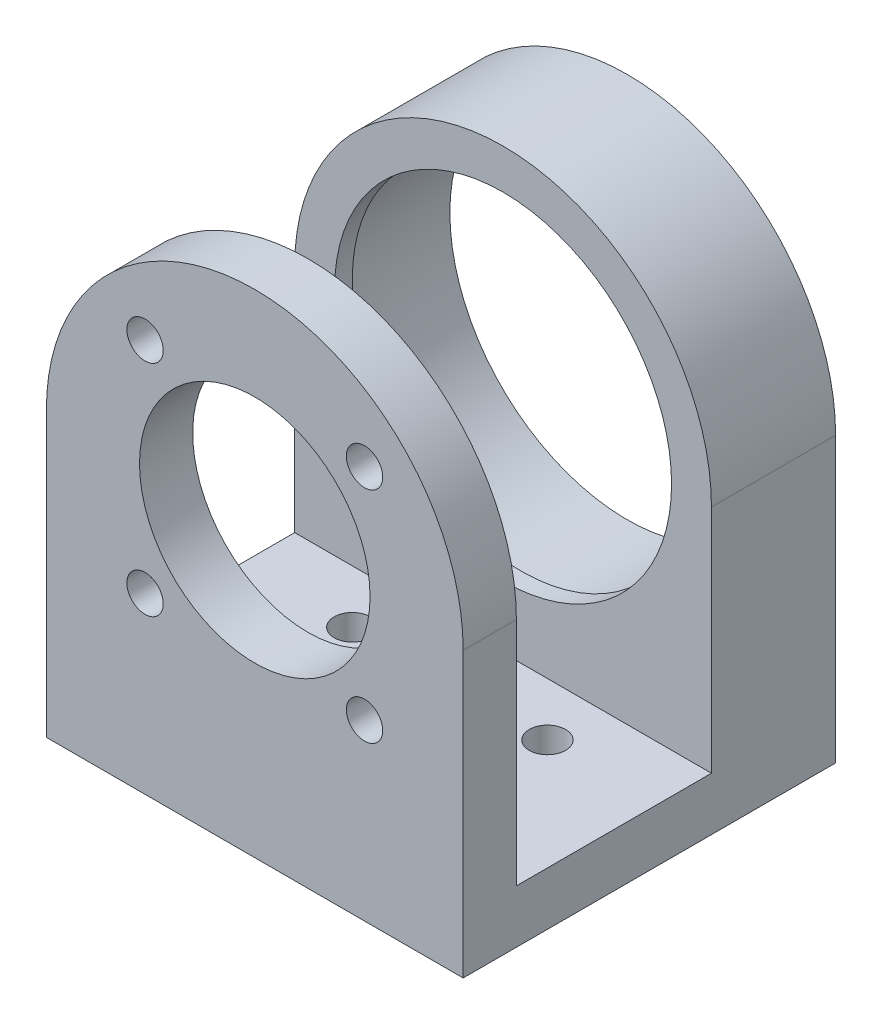
from build123d import *

# Parameters (mm, degrees)
EXTRUDE_1_DEPTH        = 36
SKETCH_3_R             = 13
CUT_EXTRUDE_1_DEPTH    = 20
HOLE_WIZARD_M4_1_D     = 4.1
HOLE_WIZARD_M4_1_DEPTH = 20
HOLE_WIZARD_M4_1_TIP   = 1.231764269
SKETCH_17_W            = 22
SKETCH_17_H            = 45.5
CUT_EXTRUDE_4_DEPTH    = 82.149553295
HOLE_WIZARD_M4_2_D     = 4.1
HOLE_WIZARD_M4_2_DEPTH = 10.1
HOLE_WIZARD_M4_2_TIP   = 1.231764269
SKETCH_21_R            = 20
CUT_EXTRUDE_5_DEPTH    = 6
SKETCH_22_R            = 19
CUT_EXTRUDE_6_DEPTH    = 10
SKETCH_26_W            = 47
SKETCH_26_H            = 22
CUT_EXTRUDE_8_DEPTH    = 4
EXTRUDE_START          = 6
SKETCH_27_R            = 20
EXTRUDE_2_DEPTH        = 6


with BuildPart() as part:
    # 草图2 → 凸台-拉伸1 (new body)
    with BuildSketch(Plane.XY):
        with BuildLine():
            Line((-23.5, 32), (-23.5, 0))
            Line((-23.5, 0), (23.5, 0))
            Line((23.5, 0), (23.5, 32))
            ThreePointArc((23.5, 32), (0, 55.5), (-23.5, 32))
        make_face()
    extrude(amount=EXTRUDE_1_DEPTH)

    # 草图3 → 切除-拉伸1 (cut)
    with BuildSketch(Plane.XY.offset(36)):
        with Locations((0, 32)):
            Circle(SKETCH_3_R)
    extrude(amount=-CUT_EXTRUDE_1_DEPTH, mode=Mode.SUBTRACT)

    # M4 间隙孔1
    with Locations(Plane.XY.offset(36)):
        with Locations((12.374368671, 19.625631329), (-12.374368671, 44.374368671), (12.374368671, 44.374368671), (-12.374368671, 19.625631329)):
            Hole(HOLE_WIZARD_M4_1_D / 2, depth=HOLE_WIZARD_M4_1_DEPTH)
            with Locations((0, 0, -(HOLE_WIZARD_M4_1_DEPTH + HOLE_WIZARD_M4_1_TIP / 2))):  # 118° drill point
                Cone(0, HOLE_WIZARD_M4_1_D / 2, HOLE_WIZARD_M4_1_TIP, mode=Mode.SUBTRACT)

    # 草图17 → 切除-拉伸4 (cut, through all)
    with BuildSketch(Plane(origin=(23.5, 0, 0), x_dir=(0, 0, -1), z_dir=(1, 0, 0))):
        with Locations((-19, 32.75)):
            Rectangle(SKETCH_17_W, SKETCH_17_H)
    extrude(amount=-CUT_EXTRUDE_4_DEPTH, mode=Mode.SUBTRACT)

    # M4 间隙孔2
    with Locations(Plane(origin=(0, 10, 0), x_dir=(1, 0, 0), z_dir=(0, 1, 0))):
        with Locations((-11, -14), (11, -14), (11, -24), (-11, -24)):
            Hole(HOLE_WIZARD_M4_2_D / 2, depth=HOLE_WIZARD_M4_2_DEPTH)
            with Locations((0, 0, -(HOLE_WIZARD_M4_2_DEPTH + HOLE_WIZARD_M4_2_TIP / 2))):  # 118° drill point
                Cone(0, HOLE_WIZARD_M4_2_D / 2, HOLE_WIZARD_M4_2_TIP, mode=Mode.SUBTRACT)

    # 草图21 → 切除-拉伸5 (cut)
    with BuildSketch(Plane(origin=(0, 0, 0), x_dir=(-1, 0, 0), z_dir=(0, 0, -1))):
        with Locations((0, 32)):
            Circle(SKETCH_21_R)
    extrude(amount=-CUT_EXTRUDE_5_DEPTH, mode=Mode.SUBTRACT)

    # 草图22 → 切除-拉伸6 (cut)
    with BuildSketch(Plane(origin=(0, 0, 6), x_dir=(-1, 0, 0), z_dir=(0, 0, -1))):
        with Locations((0, 32)):
            Circle(SKETCH_22_R)
    extrude(amount=-CUT_EXTRUDE_6_DEPTH, mode=Mode.SUBTRACT)

    # 草图26 → 切除-拉伸8 (cut)
    with BuildSketch(Plane(origin=(0, 10, 0), x_dir=(1, 0, 0), z_dir=(0, 1, 0))):
        with Locations((0, -19)):
            Rectangle(SKETCH_26_W, SKETCH_26_H)
    extrude(amount=-CUT_EXTRUDE_8_DEPTH, mode=Mode.SUBTRACT)

    # 草图27 → 凸台-拉伸2 (add)
    with BuildSketch(Plane(origin=(0, 0, 0), x_dir=(-1, 0, 0), z_dir=(0, 0, -1)).offset(EXTRUDE_START)):
        with BuildLine():
            Line((-23.5, 32), (-23.5, 0))
            Line((-23.5, 0), (23.5, 0))
            Line((23.5, 0), (23.5, 32))
            ThreePointArc((23.5, 32), (0, 55.5), (-23.5, 32))
        make_face()
        with Locations((0, 32)):
            Circle(SKETCH_27_R, mode=Mode.SUBTRACT)
    extrude(amount=-EXTRUDE_2_DEPTH)


solid = part.part
